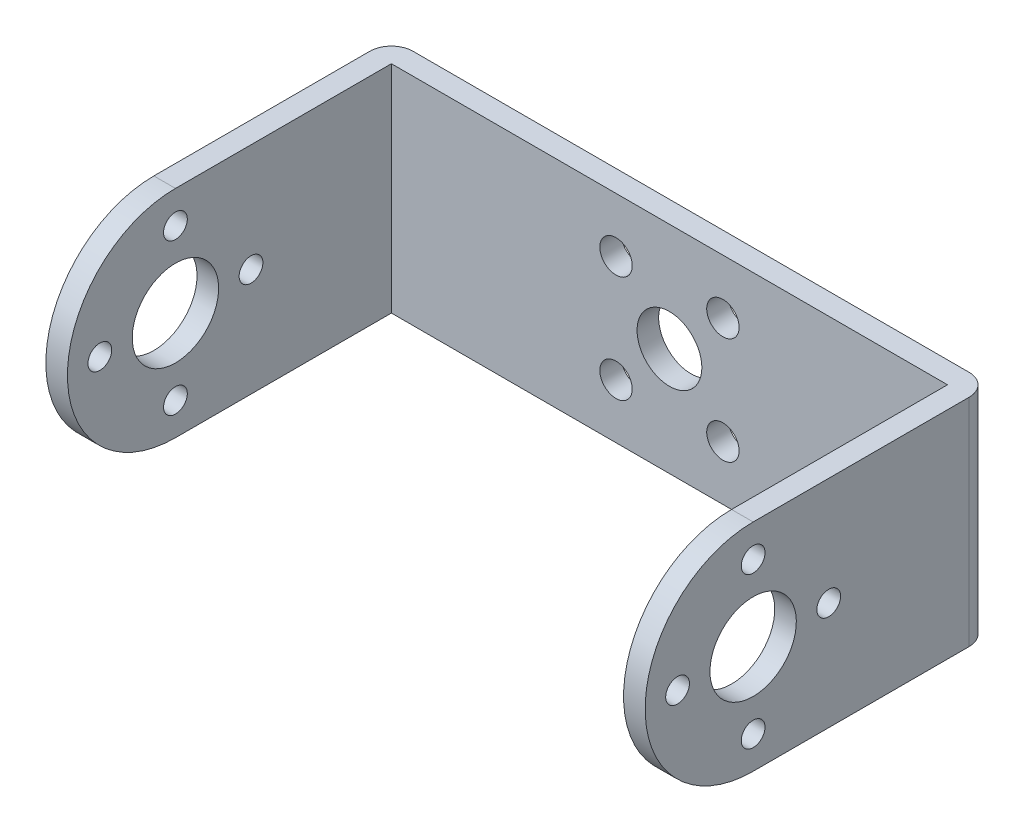
from build123d import *

# Parameters (mm, degrees)
SKETCH_1_W      = 55.5
SKETCH_1_H      = 20
SKETCH_1_R      = 3
SKETCH_1_R_2    = 1.5
EXTRUDE_1_DEPTH = 2
SKETCH_2_R      = 4
SKETCH_2_R_2    = 1.1
EXTRUDE_2_DEPTH = 2
FILLET_1_R      = 2


with BuildPart() as part:
    # 草图1 → 凸台-拉伸1 (new body)
    with BuildSketch(Plane.XY):
        Rectangle(SKETCH_1_W, SKETCH_1_H)
        Circle(SKETCH_1_R, mode=Mode.SUBTRACT)
        with Locations((-4.949747468, 4.949747468)):
            Circle(SKETCH_1_R_2, mode=Mode.SUBTRACT)
        with Locations((4.949747468, 4.949747468)):
            Circle(SKETCH_1_R_2, mode=Mode.SUBTRACT)
        with Locations((4.949747468, -4.949747468)):
            Circle(SKETCH_1_R_2, mode=Mode.SUBTRACT)
        with Locations((-4.949747468, -4.949747468)):
            Circle(SKETCH_1_R_2, mode=Mode.SUBTRACT)
    extrude(amount=EXTRUDE_1_DEPTH)

    # 草图2 → 凸台-拉伸2 (add)
    with BuildSketch(Plane.ZY.offset(27.75)):
        with BuildLine():
            Line((2, 10), (2, -10))
            Line((2, -10), (22, -10))
            ThreePointArc((22, -10), (32, 0), (22, 10))
            Line((22, 10), (2, 10))
        make_face()
        with Locations(Location((22, 0, 0), (0, 0, 270))):
            Circle(SKETCH_2_R, mode=Mode.SUBTRACT)
        with Locations(Location((29, 0, 0), (0, 0, 270))):
            Circle(SKETCH_2_R_2, mode=Mode.SUBTRACT)
        with Locations(Location((22, -7, 0), (0, 0, 270))):
            Circle(SKETCH_2_R_2, mode=Mode.SUBTRACT)
        with Locations(Location((15, 0, 0), (0, 0, 270))):
            Circle(SKETCH_2_R_2, mode=Mode.SUBTRACT)
        with Locations(Location((22, 7, 0), (0, 0, 270))):
            Circle(SKETCH_2_R_2, mode=Mode.SUBTRACT)
    extrude_2 = extrude(amount=-EXTRUDE_2_DEPTH)

    # 镜向1: 凸台-拉伸2 across plane
    add(extrude_2.mirror(Plane(origin=(0, 0, 0), x_dir=(0, 0, 1), z_dir=(1, 0, 0))))

    # 圆角1
    fillet_1_edges = [part.edges().sort_by_distance(p)[0] for p in [
        (-27.75, 0, 0),
        (27.75, 0, 0),
    ]]
    fillet(fillet_1_edges, radius=FILLET_1_R)


solid = part.part
